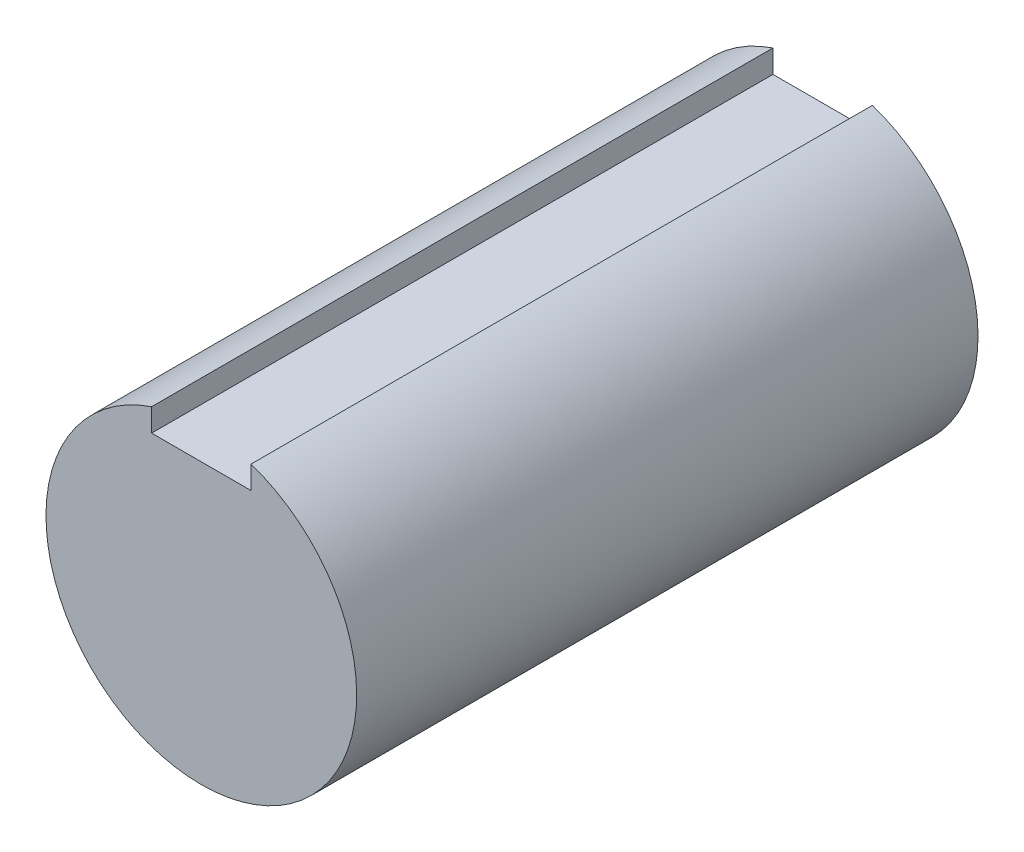
from build123d import *

# Parameters (mm, degrees)
SKETCH1_R           = 25
BOSS_EXTRUDE2_DEPTH = 100
CUT_EXTRUDE2_DEPTH  = 246


with BuildPart() as part:
    # Sketch1 → Boss-Extrude2 (new body)
    with BuildSketch(Plane.XY):
        Circle(SKETCH1_R)
    extrude(amount=BOSS_EXTRUDE2_DEPTH)

    # Sketch3 → Cut-Extrude2 (cut)
    with BuildSketch(Plane.XY.offset(100)):
        Polygon((-8, 151.316589681), (-8, 23.685438565), (-8, 20), (8, 20), (8, 23.685438565), (8, 151.316589681), (8, 406.578891913), (-8, 406.578891913), align=None)
    extrude(amount=-CUT_EXTRUDE2_DEPTH, mode=Mode.SUBTRACT)


solid = part.part
